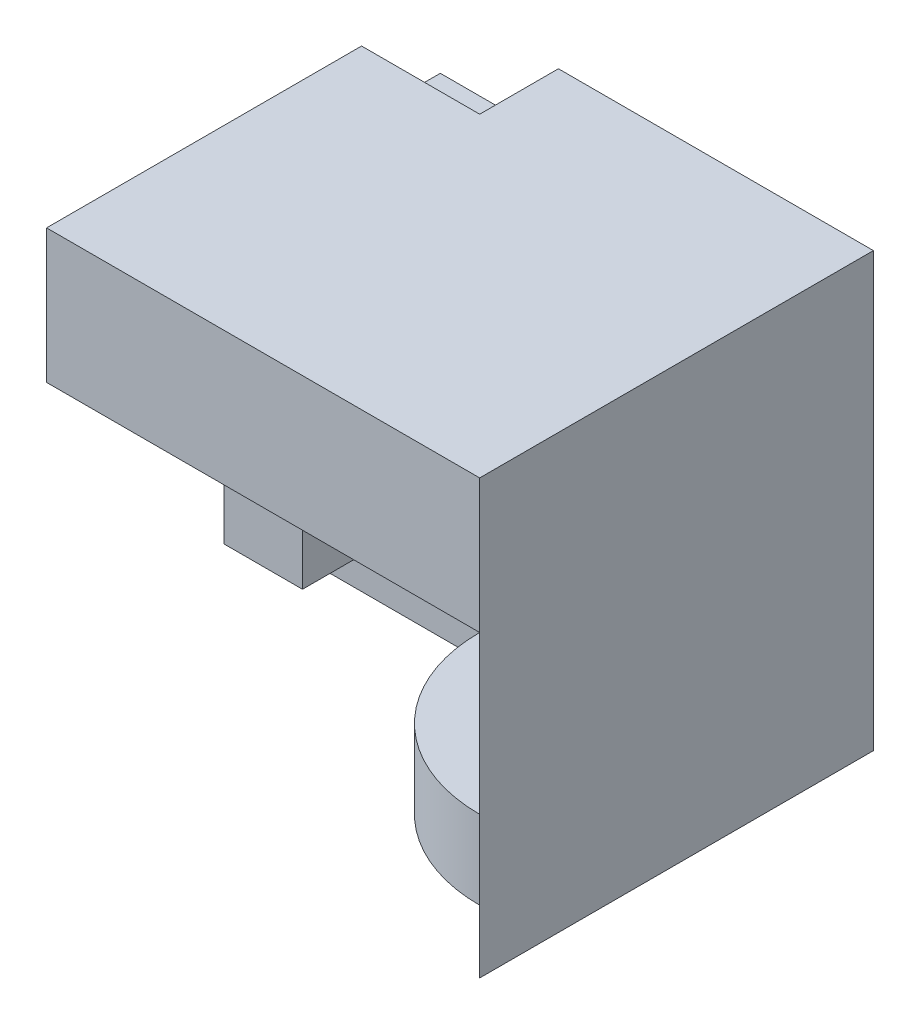
from build123d import *

# Parameters (mm, degrees)
SKETCH_1_W          = 55
SKETCH_1_H          = 55
EXTRUDE_1_DEPTH     = 50
CUT_EXTRUDE_1_DEPTH = 38
EXTRUDE_2_REACH     = 81.254
EXTRUDE_START       = -5
EXTRUDE_3_DEPTH     = 10
EXTRUDE_START_2     = -8
EXTRUDE_4_DEPTH     = 10
SKETCH_6_W          = 10
SKETCH_6_H          = 8
CUT_EXTRUDE_2_DEPTH = 15


with BuildPart() as part:
    # Эскиз1 → Бобышка-Вытянуть1 (new body)
    with BuildSketch(Plane.XY):
        Rectangle(SKETCH_1_W, SKETCH_1_H)
    extrude(amount=EXTRUDE_1_DEPTH)

    # Эскиз2 → Вырез-Вытянуть1 (cut)
    with BuildSketch(Plane.XZ.offset(27.5)):
        Polygon((-27.5, 15), (7.5, 15), (7.5, 30), (27.5, 50), (-27.5, 50), align=None)
    extrude(amount=-CUT_EXTRUDE_1_DEPTH, mode=Mode.SUBTRACT)

    # Бобышка-Вытянуть2: up to this face of the body (flat: up to its plane)
    extrude_2_end = Plane(part.part.faces().sort_by_distance((27.5, 0, 25))[0])
    # Эскиз3 → Бобышка-Вытянуть2 (add, up to the picked face)
    with BuildSketch(Plane.ZY.offset(27.5), mode=Mode.PRIVATE) as extrude_2_sk1:
        Polygon((50, 10.5), (15, -13.5), (15, 10.5), align=None)
    extrude_2_tool1 = split(extrude(extrude_2_sk1.sketch, amount=-EXTRUDE_2_REACH, mode=Mode.PRIVATE), bisect_by=extrude_2_end, keep=Keep.BOTH, mode=Mode.PRIVATE)
    add(extrude_2_tool1.solids().sort_by(Axis((-27.5, 2.5, 26.666667), (1, 0, 0)))[0])

    # Эскиз4 → Бобышка-Вытянуть3 (add)
    with BuildSketch(Plane.ZY.offset(27.5).offset(EXTRUDE_START)):
        Polygon((32.5, -1.5), (32.5, -13.5), (15, -13.5), align=None)
    extrude(amount=-EXTRUDE_3_DEPTH)

    # Эскиз5 → Бобышка-Вытянуть4 (add)
    with BuildSketch(Plane.XZ.offset(27.5).offset(EXTRUDE_START_2)):
        with BuildLine():
            Line((27.5, 50), (7.5, 30))
            ThreePointArc((7.5, 30), (13.357864376, 44.142135624), (27.5, 50))
        make_face()
    extrude(amount=-EXTRUDE_4_DEPTH)

    # Эскиз6 → Вырез-Вытянуть2 (cut)
    with BuildSketch(Plane.ZY.offset(27.5)):
        with Locations((5, 23.5)):
            Rectangle(SKETCH_6_W, SKETCH_6_H)
    extrude(amount=-CUT_EXTRUDE_2_DEPTH, mode=Mode.SUBTRACT)


solid = part.part
